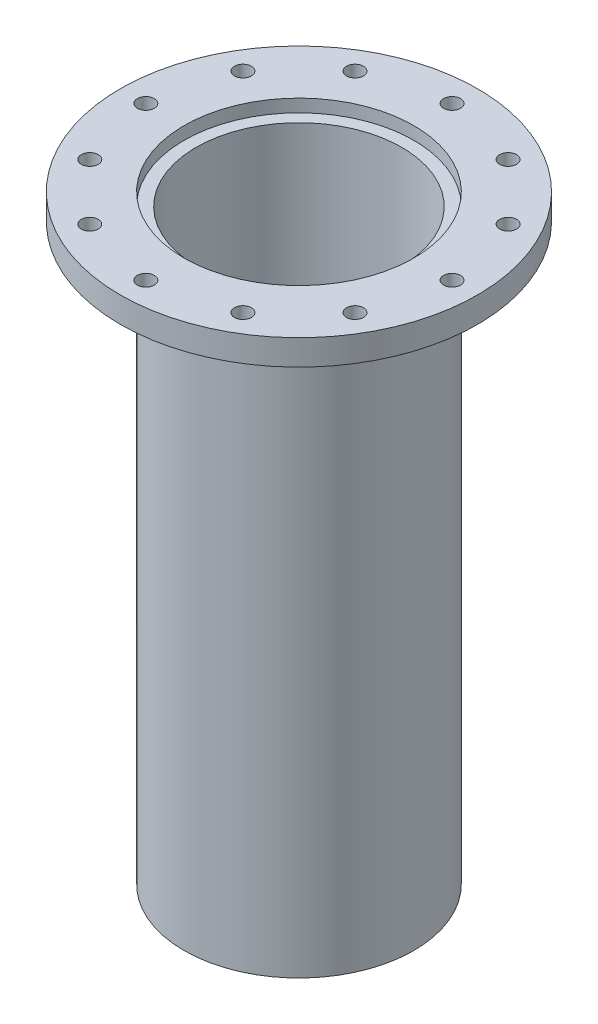
from build123d import *

# Parameters (mm, degrees)
F_5_16_CLEARANCE_HOLE1_D = 8.4328
CIRPATTERN1_COUNT        = 12


with BuildPart() as part:
    # Sketch1 → Revolve1 (revolve)
    with BuildSketch(Plane.XY, mode=Mode.PRIVATE) as revolve1_sk:
        Polygon((-57.15, 0), (-88.9, 0), (-88.9, -12.7), (-57.15, -12.7), (-57.15, -298.45), (-51.1302, -298.45), (-51.1302, -6.35), (-57.15, -6.35), align=None)
    revolve(revolve1_sk.sketch.rotate(Axis((0, 0, 0), (0, -1, 0)), 270), axis=Axis((0, 0, 0), (0, -1, 0)))

    # 5/16 Clearance Hole1 (through all)
    with Locations(Plane(origin=(0, 0, 0), x_dir=(1, 0, 0), z_dir=(0, 1, 0))):
        with Locations((-76.2, 0)):
            f_5_16_clearance_hole1 = Hole(F_5_16_CLEARANCE_HOLE1_D / 2)

    # CirPattern1: 5/16 Clearance Hole1 ×12 about axis
    cirpattern1_axis = Axis((0, 0, 0), (0, 1, 0))
    for i in range(1, CIRPATTERN1_COUNT):
        add(f_5_16_clearance_hole1.rotate(cirpattern1_axis, i * 360 / CIRPATTERN1_COUNT), mode=Mode.SUBTRACT)


solid = part.part
